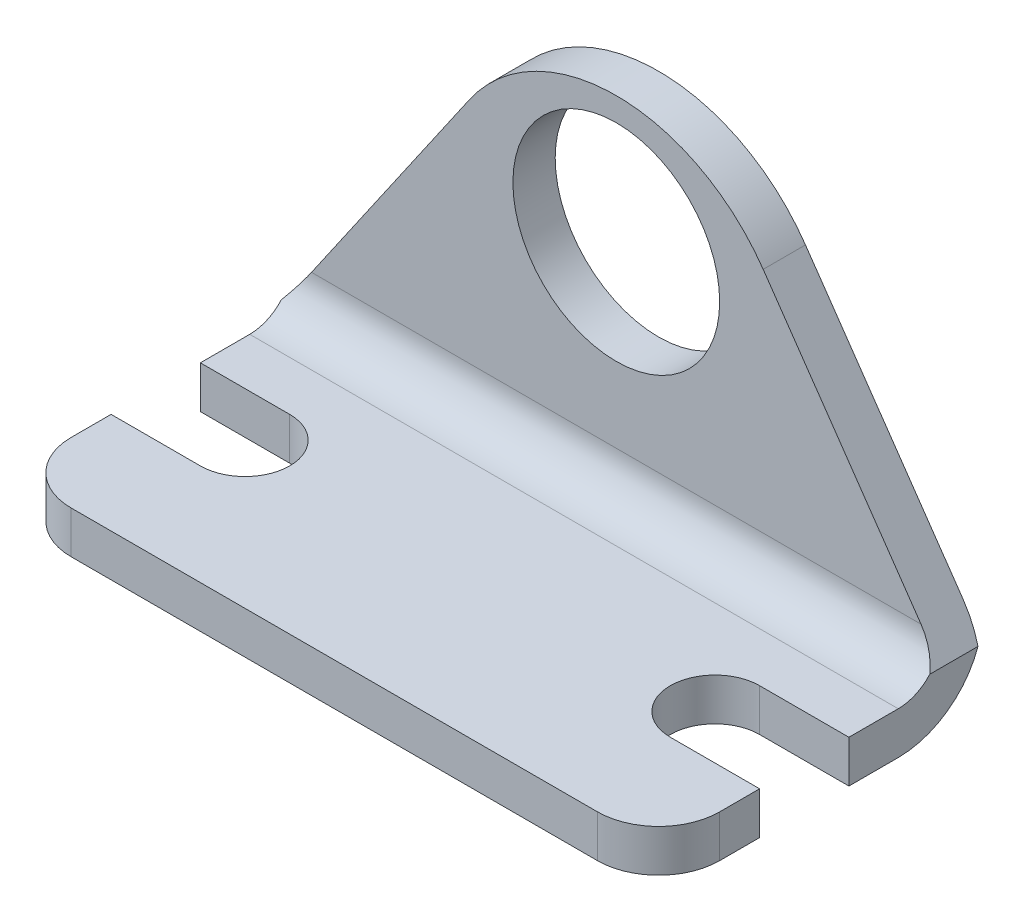
from build123d import *

# Parameters (mm, degrees)
SKETCH1_R           = 5.588
BOSS_EXTRUDE1_DEPTH = 2.286
BOSS_EXTRUDE2_DEPTH = 2.286
FILLET1_R           = 2.286
FILLET2_R           = 4.572


with BuildPart() as part:
    # Sketch1 → Boss-Extrude1 (new body)
    with BuildSketch(Plane.XY):
        with BuildLine():
            Line((-17.526, 0), (17.526, 0))
            Line((17.526, 0), (17.526, 3.048))
            Line((17.526, 3.048), (7.94015483, 16.917717675))
            ThreePointArc((7.94015483, 16.917717675), (0, 21.082), (-7.94015483, 16.917717675))
            Line((-7.94015483, 16.917717675), (-17.526, 3.048))
            Line((-17.526, 3.048), (-17.526, 0))
        make_face()
        with Locations((0, 14.224)):
            Circle(SKETCH1_R, mode=Mode.SUBTRACT)
    extrude(amount=BOSS_EXTRUDE1_DEPTH)

    # Sketch2 → Boss-Extrude2 (add)
    with BuildSketch(Plane(origin=(0, 0, 2.286), x_dir=(1, 0, 0), z_dir=(0, 1, 0))):
        with BuildLine():
            Line((-12.7, -4.953), (-17.526, -4.953))
            Line((-17.526, -4.953), (-17.526, 2.286))
            Line((-17.526, 2.286), (17.526, 2.286))
            Line((17.526, 2.286), (17.526, -4.953))
            Line((17.526, -4.953), (12.7, -4.953))
            ThreePointArc((12.7, -4.953), (10.287, -7.366), (12.7, -9.779))
            Line((12.7, -9.779), (17.526, -9.779))
            Line((17.526, -9.779), (17.526, -11.938))
            ThreePointArc((17.526, -11.938), (16.558866591, -14.272866591), (14.224, -15.24))
            Line((14.224, -15.24), (-14.224, -15.24))
            ThreePointArc((-14.224, -15.24), (-16.558866591, -14.272866591), (-17.526, -11.938))
            Line((-17.526, -11.938), (-17.526, -9.779))
            Line((-17.526, -9.779), (-12.7, -9.779))
            ThreePointArc((-12.7, -9.779), (-10.287, -7.366), (-12.7, -4.953))
        make_face()
    extrude(amount=BOSS_EXTRUDE2_DEPTH)

    # Fillet1
    fillet1_edges = [part.edges().sort_by_distance(p)[0] for p in [
        (0, 2.286, 2.286),
    ]]
    fillet(fillet1_edges, radius=FILLET1_R)

    # Fillet2
    fillet2_edges = [part.edges().sort_by_distance(p)[0] for p in [
        (0, 0, 0),
    ]]
    fillet(fillet2_edges, radius=FILLET2_R)


solid = part.part
